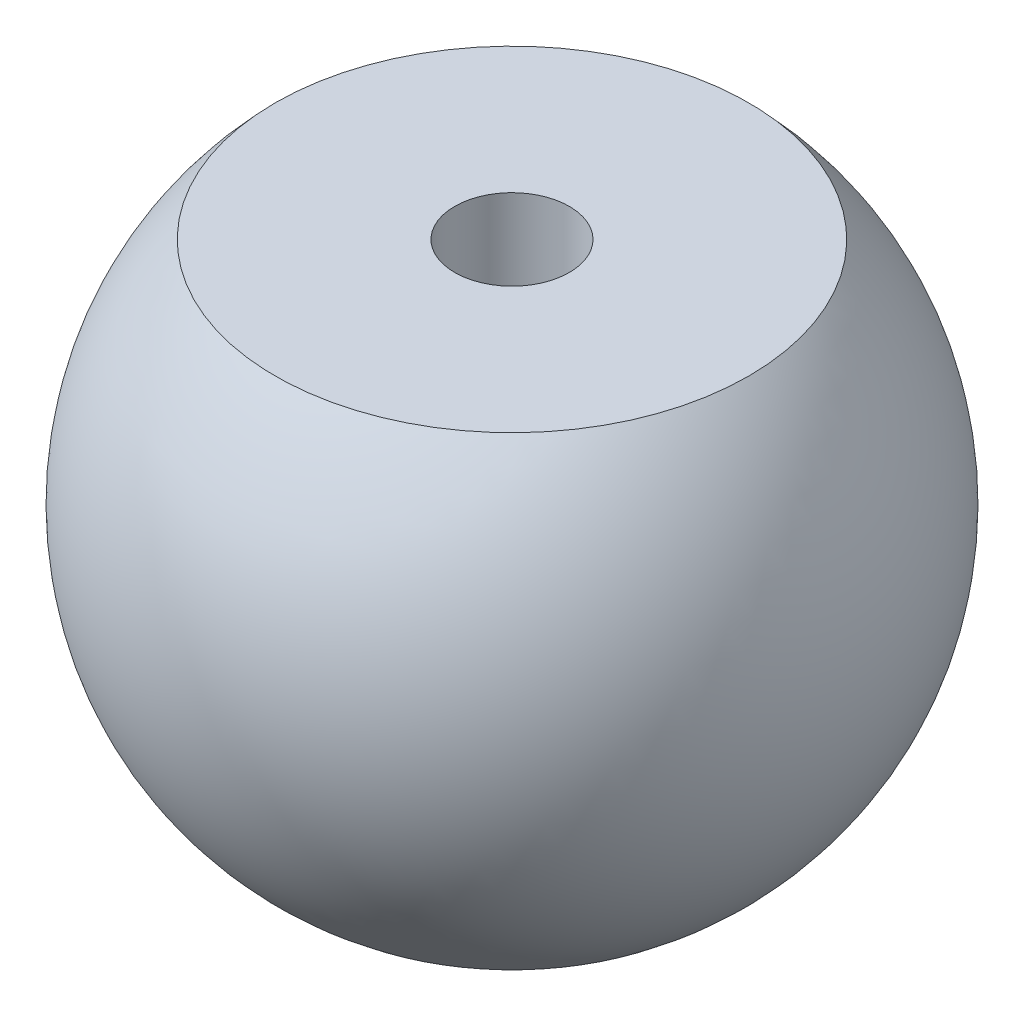
from build123d import *


with BuildPart() as part:
    # Sketch1 → Revolve1 (revolve)
    with BuildSketch(Plane.XY):
        with BuildLine():
            Line((2, -11), (3.354101966, -11))
            ThreePointArc((3.354101966, -11), (11.134617861, -2.875810338), (8.261355821, 8))
            Line((8.261355821, 8), (2, 8))
            Line((2, 8), (2, 2.415501525))
            Line((2, 2.415501525), (2, -11))
        make_face()
    revolve(axis=Axis((0, 18.281505275, 0), (0, -1, 0)))


solid = part.part
